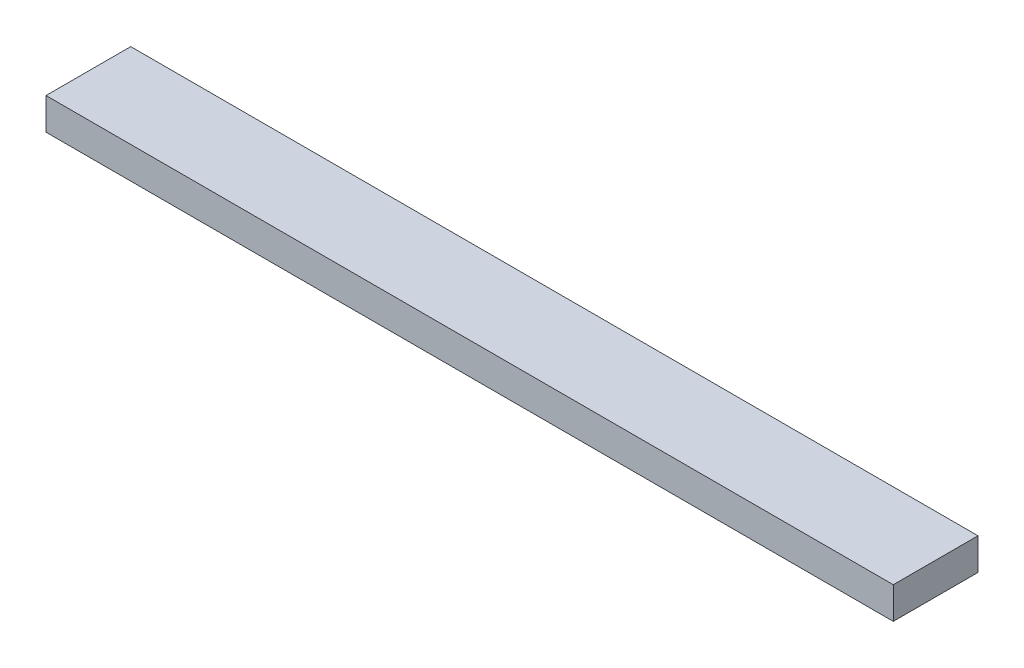
from build123d import *

# Parameters (mm, degrees)
SKETCH1_W           = 508
SKETCH1_H           = 50.8
BOSS_EXTRUDE1_DEPTH = 19.05


with BuildPart() as part:
    # Sketch1 → Boss-Extrude1 (new body)
    with BuildSketch(Plane(origin=(0, 0, 0), x_dir=(1, 0, 0), z_dir=(0, 1, 0))):
        Rectangle(SKETCH1_W, SKETCH1_H)
    extrude(amount=BOSS_EXTRUDE1_DEPTH)


solid = part.part
